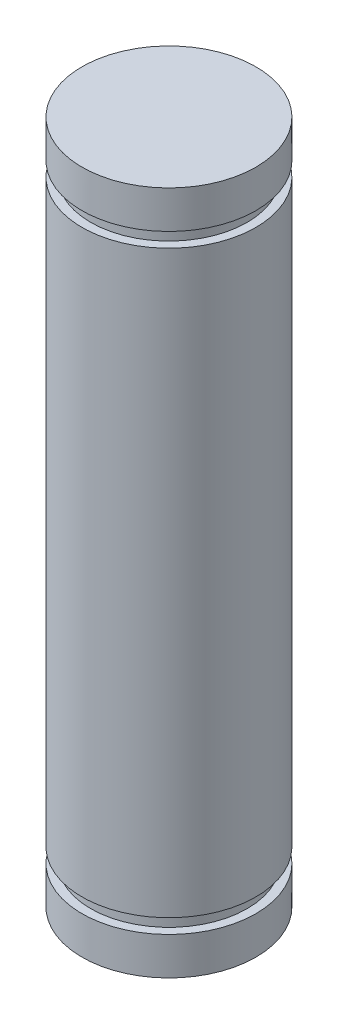
from build123d import *

# Parameters (mm, degrees)
ESBO_O1_W = 3
ESBO_O1_H = 23.6
ESBO_O2_W = 0.3
ESBO_O2_H = 0.5


with BuildPart() as part:
    # Esboço1 → Revolução1 (revolve)
    with BuildSketch(Plane.XY, mode=Mode.PRIVATE) as revolu_o1_sk:
        with Locations((-1.5, 0)):
            Rectangle(ESBO_O1_W, ESBO_O1_H)
    revolve(revolu_o1_sk.sketch.rotate(Axis((0, -11.8, 0), (0, 1, 0)), 180), axis=Axis((0, -11.8, 0), (0, 1, 0)))

    # Esboço2 → Corte-Revolução3 (revolve, cut)
    with BuildSketch(Plane.XY, mode=Mode.PRIVATE) as corte_revolu_o3_sk:
        with Locations((-2.85, -10.25)):
            Rectangle(ESBO_O2_W, ESBO_O2_H)
        with Locations((-2.85, 10.25)):
            Rectangle(ESBO_O2_W, ESBO_O2_H)
    revolve(corte_revolu_o3_sk.sketch.rotate(Axis((0, 0, 0), (0, 1, 0)), 270), axis=Axis((0, 0, 0), (0, 1, 0)), mode=Mode.SUBTRACT)


solid = part.part
